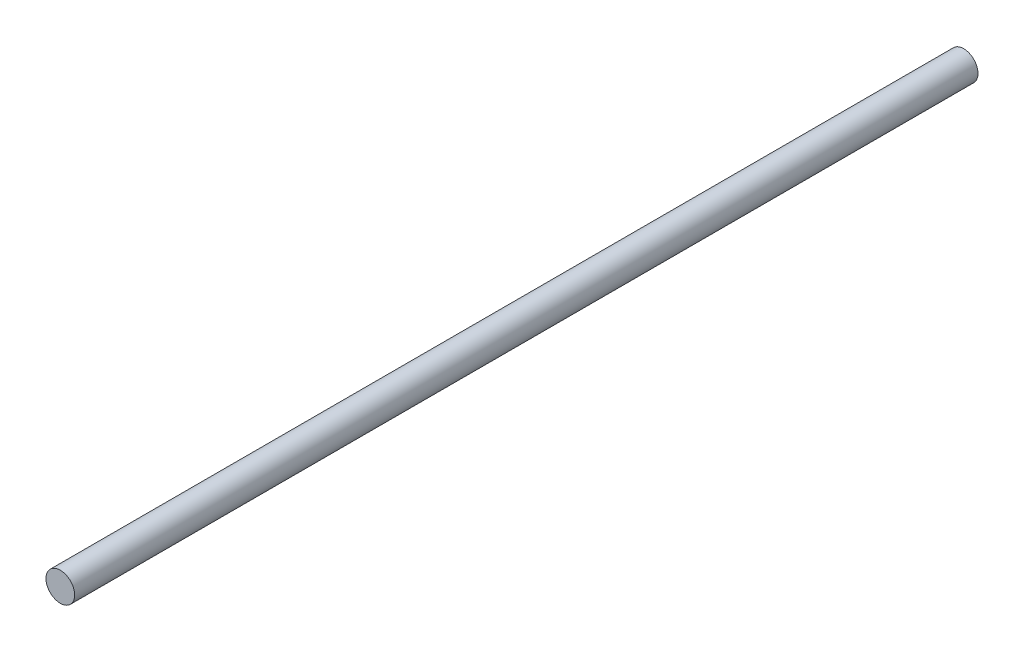
from build123d import *

# Parameters (mm, degrees)
SKETCH1_R           = 3.175
BOSS_EXTRUDE1_DEPTH = 200


with BuildPart() as part:
    # Sketch1 → Boss-Extrude1 (new body)
    with BuildSketch(Plane.XY):
        Circle(SKETCH1_R)
    extrude(amount=BOSS_EXTRUDE1_DEPTH)


solid = part.part
